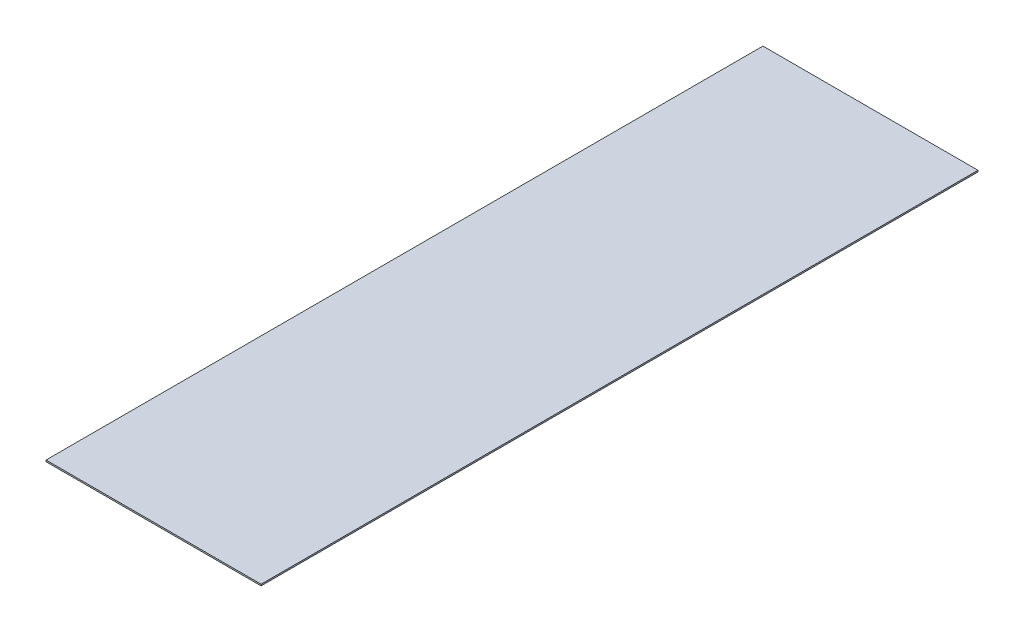
from build123d import *

# Parameters (mm, degrees)
CROQUIS1_W              = 914.4
CROQUIS1_H              = 3048
SALIENTE_EXTRUIR1_DEPTH = 6.4


with BuildPart() as part:
    # Croquis1 → Saliente-Extruir1 (new body)
    with BuildSketch(Plane(origin=(0, 0, 0), x_dir=(1, 0, 0), z_dir=(0, 1, 0))):
        Rectangle(CROQUIS1_W, CROQUIS1_H)
    extrude(amount=SALIENTE_EXTRUIR1_DEPTH)


solid = part.part
